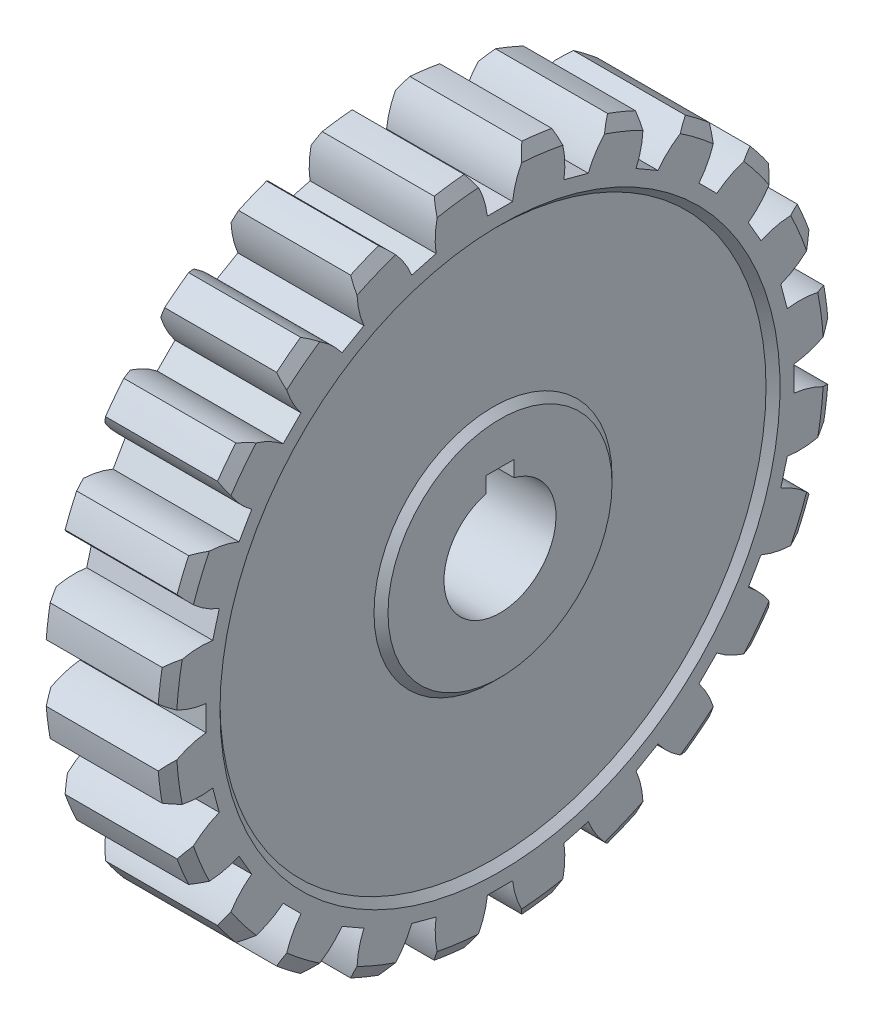
from build123d import *

# Parameters (mm, degrees)
CUT_EXTRUDE1_DEPTH = 112.48726665
CIRPATTERN1_COUNT  = 24
CUT_EXTRUDE2_DEPTH = 112.102899965


with BuildPart() as part:
    # Sketch2 → Revolve1 (revolve)
    with BuildSketch(Plane.XY, mode=Mode.PRIVATE) as revolve1_sk:
        Polygon((-12.7, 76.2), (12.7, 76.2), (14.2875, 73.450369343), (14.2875, 63.5), (12.7, 61.9125), (12.7, 26.9875), (14.2875, 25.4), (14.2875, 12.7), (-14.2875, 12.7), (-14.2875, 25.4), (-12.7, 26.9875), (-12.7, 61.9125), (-14.2875, 63.5), (-14.2875, 73.450369343), align=None)
    revolve(revolve1_sk.sketch.rotate(Axis((-113.728031864, 0, 0), (1, 0, 0)), 90), axis=Axis((-113.728031864, 0, 0), (1, 0, 0)))

    # Sketch3 → Cut-Extrude1 (cut, through all)
    with BuildSketch(Plane.ZY.offset(14.2875)):
        with BuildLine():
            Line((-2.8575, 66.675), (2.8575, 66.675))
            ThreePointArc((2.8575, 66.675), (4.084797701, 71.541608863), (6.5405, 75.91878463))
            ThreePointArc((6.5405, 75.91878463), (0, 76.2), (-6.5405, 75.91878463))
            ThreePointArc((-6.5405, 75.91878463), (-4.084797701, 71.541608863), (-2.8575, 66.675))
        make_face()
    cut_extrude1 = extrude(amount=-CUT_EXTRUDE1_DEPTH, mode=Mode.SUBTRACT)

    # CirPattern1: Cut-Extrude1 ×24 about axis
    cirpattern1_axis = Axis((0, 0, 0), (1, 0, 0))
    for i in range(1, CIRPATTERN1_COUNT):
        add(cut_extrude1.rotate(cirpattern1_axis, i * 360 / CIRPATTERN1_COUNT), mode=Mode.SUBTRACT)

    # Sketch4 → Cut-Extrude2 (cut, through all)
    with BuildSketch(Plane.ZY.offset(14.2875)):
        with BuildLine():
            Line((0, 12.7), (0, 15.875))
            Line((0, 15.875), (-3.175, 15.875))
            Line((-3.175, 15.875), (-3.175, 12.296722124))
            ThreePointArc((-3.175, 12.296722124), (-1.600254515, 12.598777143), (0, 12.7))
        make_face()
        with BuildLine():
            Line((3.175, 15.875), (0, 15.875))
            Line((0, 15.875), (0, 12.7))
            ThreePointArc((0, 12.7), (1.600254515, 12.598777143), (3.175, 12.296722124))
            Line((3.175, 12.296722124), (3.175, 15.875))
        make_face()
    extrude(amount=-CUT_EXTRUDE2_DEPTH, mode=Mode.SUBTRACT)


solid = part.part
